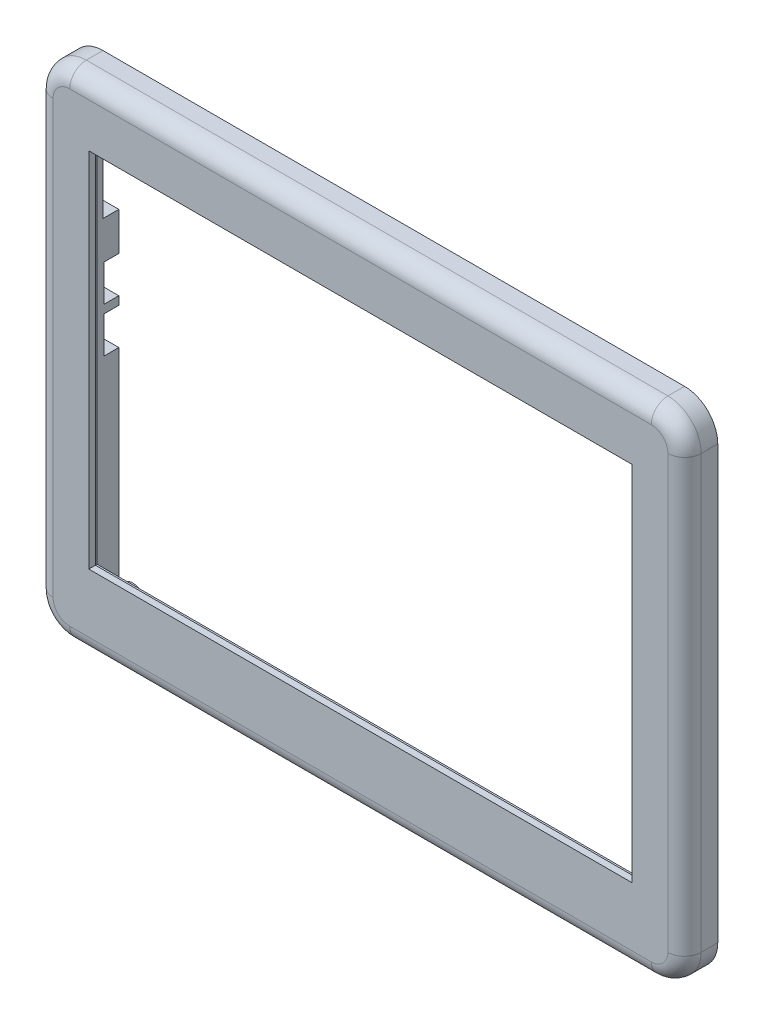
from build123d import *

# Parameters (mm, degrees)
BOSS_EXTRU_1_DEPTH      = 10
ESQUISSE2_W             = 163.5
ESQUISSE2_H             = 109
ENL_V_MAT_EXTRU_1_DEPTH = 10
ESQUISSE3_W             = 164.5
ESQUISSE3_H             = 110
ENL_V_MAT_EXTRU_2_DEPTH = 8
ENL_V_MAT_EXTRU_3_DEPTH = 7
ESQUISSE5_R             = 3.5
ESQUISSE5_R_2           = 1.25
BOSS_EXTRU_2_DEPTH      = 7
CONG_1_R                = 5
ESQUISSE6_W             = 12.13
ESQUISSE6_H             = 21
ESQUISSE6_W_2           = 8
ESQUISSE6_H_2           = 11
ENL_V_MAT_EXTRU_4_DEPTH = 97.5


with BuildPart() as part:
    # Esquisse1 → Boss.-Extru.1 (new body)
    with BuildSketch(Plane.XY):
        with BuildLine():
            Line((87.5, -75), (-87.5, -75))
            ThreePointArc((-87.5, -75), (-94.571067812, -72.071067812), (-97.5, -65))
            Line((-97.5, -65), (-97.5, 65))
            ThreePointArc((-97.5, 65), (-94.571067812, 72.071067812), (-87.5, 75))
            Line((-87.5, 75), (87.5, 75))
            ThreePointArc((87.5, 75), (94.571067812, 72.071067812), (97.5, 65))
            Line((97.5, 65), (97.5, -65))
            ThreePointArc((97.5, -65), (94.571067812, -72.071067812), (87.5, -75))
        make_face()
    extrude(amount=BOSS_EXTRU_1_DEPTH)

    # Esquisse2 → Enlèv. mat.-Extru.1 (cut)
    with BuildSketch(Plane.XY.offset(10)):
        with Locations((0, 2.25)):
            Rectangle(ESQUISSE2_W, ESQUISSE2_H)
    extrude(amount=-ENL_V_MAT_EXTRU_1_DEPTH, mode=Mode.SUBTRACT)

    # Esquisse3 → Enlèv. mat.-Extru.2 (cut)
    with BuildSketch(Plane(origin=(0, 0, 0), x_dir=(-1, 0, 0), z_dir=(0, 0, -1))):
        with Locations((0, 2.25)):
            Rectangle(ESQUISSE3_W, ESQUISSE3_H)
    extrude(amount=-ENL_V_MAT_EXTRU_2_DEPTH, mode=Mode.SUBTRACT)

    # Esquisse4 → Enlèv. mat.-Extru.3 (cut)
    with BuildSketch(Plane(origin=(0, 0, 0), x_dir=(-1, 0, 0), z_dir=(0, 0, -1))):
        with BuildLine():
            Line((-74.305753882, -63.01), (74.305753882, -63.01))
            ThreePointArc((74.305753882, -63.01), (78.51, -67.214246118), (82.714246118, -63.01))
            Line((82.714246118, -63.01), (82.714246118, 63.01))
            ThreePointArc((82.714246118, 63.01), (78.51, 67.214246118), (74.305753882, 63.01))
            Line((74.305753882, 63.01), (-74.305753882, 63.01))
            ThreePointArc((-74.305753882, 63.01), (-78.51, 67.214246118), (-82.714246118, 63.01))
            Line((-82.714246118, 63.01), (-82.714246118, -63.01))
            ThreePointArc((-82.714246118, -63.01), (-78.51, -67.214246118), (-74.305753882, -63.01))
        make_face()
    extrude(amount=-ENL_V_MAT_EXTRU_3_DEPTH, mode=Mode.SUBTRACT)

    # Esquisse5 → Boss.-Extru.2 (add)
    # profile 1 of 4: a face of its own
    with BuildSketch(Plane(origin=(0, 0, 7), x_dir=(-1, 0, 0), z_dir=(0, 0, -1))):
        with Locations(Location((-78.5, -62.75, 0), (0, 0, 180))):
            Circle(ESQUISSE5_R)
        with Locations(Location((-78.5, -62.75, 0), (0, 0, 180))):
            Circle(ESQUISSE5_R_2, mode=Mode.SUBTRACT)
    # profile 2 of 4: a face of its own
    with BuildSketch(Plane(origin=(0, 0, 7), x_dir=(-1, 0, 0), z_dir=(0, 0, -1))):
        with Locations(Location((78.5, -62.75, 0), (0, 0, 180))):
            Circle(ESQUISSE5_R)
        with Locations(Location((78.5, -62.75, 0), (0, 0, 180))):
            Circle(ESQUISSE5_R_2, mode=Mode.SUBTRACT)
    # profile 3 of 4: a face of its own
    with BuildSketch(Plane(origin=(0, 0, 7), x_dir=(-1, 0, 0), z_dir=(0, 0, -1))):
        with Locations(Location((78.5, 62.75, 0), (0, 0, 180))):
            Circle(ESQUISSE5_R)
        with Locations(Location((78.5, 62.75, 0), (0, 0, 180))):
            Circle(ESQUISSE5_R_2, mode=Mode.SUBTRACT)
    # profile 4 of 4: a face of its own
    with BuildSketch(Plane(origin=(0, 0, 7), x_dir=(-1, 0, 0), z_dir=(0, 0, -1))):
        with Locations(Location((-78.5, 62.75, 0), (0, 0, 180))):
            Circle(ESQUISSE5_R)
        with Locations(Location((-78.5, 62.75, 0), (0, 0, 180))):
            Circle(ESQUISSE5_R_2, mode=Mode.SUBTRACT)
    extrude(amount=BOSS_EXTRU_2_DEPTH)

    # Congé1
    cong_1_edges = [part.edges().sort_by_distance(p)[0] for p in [
        (-94.571067812, 72.071067812, 10),
        (-97.5, 0, 10),
        (-94.571067812, -72.071067812, 10),
        (0, -75, 10),
        (94.571067812, -72.071067812, 10),
        (97.5, 0, 10),
        (94.571067812, 72.071067812, 10),
        (0, 75, 10),
    ]]
    fillet(cong_1_edges, radius=CONG_1_R)

    # Esquisse6 → Enlèv. mat.-Extru.4 (cut)
    with BuildSketch(Plane(origin=(0, 0, 0), x_dir=(0, 0, -1), z_dir=(1, 0, 0))):
        with Locations((1.265, 46.5)):
            Rectangle(ESQUISSE6_W, ESQUISSE6_H)
        with Locations((-0.5, 19)):
            Rectangle(ESQUISSE6_W_2, ESQUISSE6_H_2)
        with Locations((-0.5, 5.5)):
            Rectangle(ESQUISSE6_W_2, ESQUISSE6_H_2)
    extrude(amount=-ENL_V_MAT_EXTRU_4_DEPTH, mode=Mode.SUBTRACT)


solid = part.part
